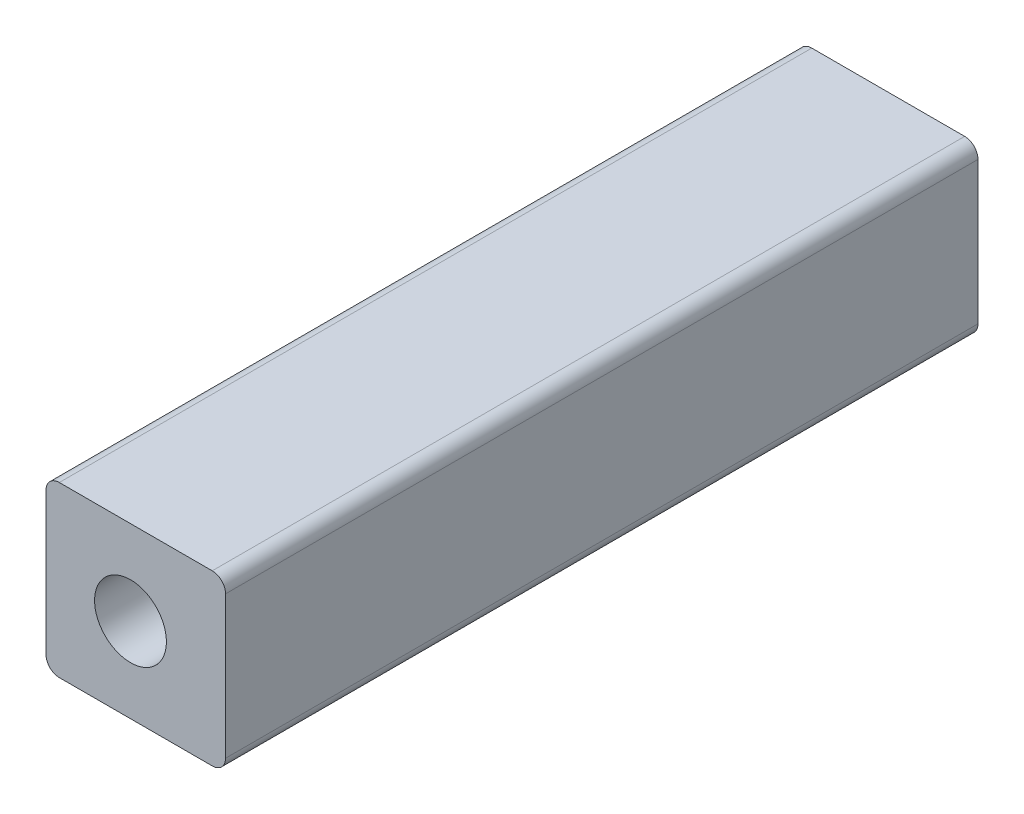
from build123d import *

# Parameters (mm, degrees)
SKETCH1_W           = 12.7
SKETCH1_H           = 12.7
SKETCH1_R           = 2.7
BOSS_EXTRUDE1_DEPTH = 28.275
SKETCH4_W           = 56.55
SKETCH4_H           = 12.7
BOSS_EXTRUDE3_DEPTH = 0.79375
FILLET2_R           = 1


with BuildPart() as part:
    # Sketch1 → Boss-Extrude1 (new, symmetric)
    with BuildSketch(Plane.XY):
        Rectangle(SKETCH1_W, SKETCH1_H)
        Circle(SKETCH1_R, mode=Mode.SUBTRACT)
    extrude(amount=BOSS_EXTRUDE1_DEPTH, both=True)

    # Sketch4 → Boss-Extrude3 (add)
    with BuildSketch(Plane(origin=(6.35, 0, 0), x_dir=(0, 0, -1), z_dir=(1, 0, 0))):
        Rectangle(SKETCH4_W, SKETCH4_H)
    extrude(amount=BOSS_EXTRUDE3_DEPTH)

    # Fillet2
    fillet2_edges = [part.edges().sort_by_distance(p)[0] for p in [
        (7.14375, -6.35, 0),
        (7.14375, 6.35, 0),
        (-6.35, -6.35, 0),
        (-6.35, 6.35, 0),
    ]]
    fillet(fillet2_edges, radius=FILLET2_R)


solid = part.part
